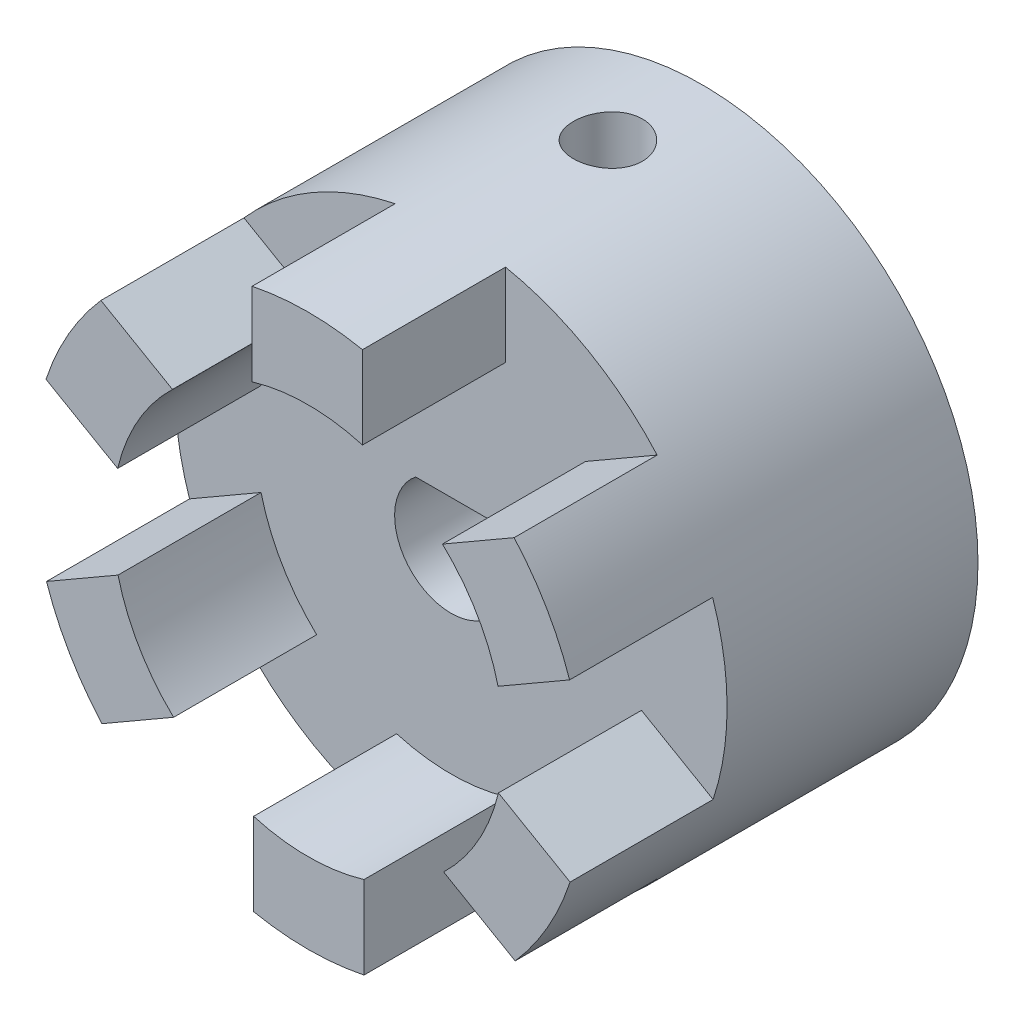
from build123d import *

# Parameters (mm, degrees)
BOSS_EXTRUDE1_DEPTH   = 11.4
BOSS_EXTRUDE1_2_DEPTH = 11.4
BOSS_EXTRUDE1_3_DEPTH = 11.4
BOSS_EXTRUDE1_4_DEPTH = 11.4
BOSS_EXTRUDE1_5_DEPTH = 11.4
BOSS_EXTRUDE1_6_DEPTH = 11.4
BOSS_EXTRUDE2_START   = -20
SKETCH1_6_R           = 22
BOSS_EXTRUDE2_DEPTH   = 20
SKETCH2_R             = 2.75
CUT_EXTRUDE1_DEPTH    = 30


with BuildPart() as part:
    # Sketch1 → Boss-Extrude1 (new body)
    with BuildSketch(Plane.XY):
        with BuildLine():
            ThreePointArc((-4.460468257, 14.948719776), (-0.063074903, 15.599872485), (4.339440194, 14.984300411))
            Line((4.339440194, 14.984300411), (4.339440194, 21.56778289))
            ThreePointArc((4.339440194, 21.56778289), (-0.061761858, 21.999913306), (-4.460468257, 21.543078307))
            Line((-4.460468257, 21.543078307), (-4.460468257, 14.948719776))
        make_face()
    extrude(amount=BOSS_EXTRUDE1_DEPTH)



with BuildPart() as body_2:
    # Sketch1 → Boss-Extrude1 2 (new body)
    with BuildSketch(Plane.XY):
        with BuildLine():
            Line((16.426618961, 14.634417977), (10.715736951, 11.337238711))
            ThreePointArc((10.715736951, 11.337238711), (13.478348416, 7.854560711), (15.146504911, 3.734084759))
            Line((15.146504911, 3.734084759), (20.847967983, 7.025825999))
            ThreePointArc((20.847967983, 7.025825999), (19.021602875, 11.053443991), (16.426618961, 14.634417977))
        make_face()
    extrude(amount=BOSS_EXTRUDE1_2_DEPTH)


with BuildPart() as body_3:
    # Sketch1 → Boss-Extrude1 3 (new body)
    with BuildSketch(Plane.XY):
        with BuildLine():
            ThreePointArc((-15.176205208, 3.611481064), (-13.54142332, 7.745311774), (-10.807064717, 11.250215651))
            Line((-10.807064717, 11.250215651), (-16.508527789, 14.541956891))
            ThreePointArc((-16.508527789, 14.541956891), (-19.083364733, 10.946469315), (-20.887087218, 6.90866033))
            Line((-20.887087218, 6.90866033), (-15.176205208, 3.611481064))
        make_face()
    extrude(amount=BOSS_EXTRUDE1_3_DEPTH)


with BuildPart() as body_4:
    # Sketch1 → Boss-Extrude1 4 (new body)
    with BuildSketch(Plane.XY):
        with BuildLine():
            Line((20.887087218, -6.90866033), (15.176205208, -3.611481064))
            ThreePointArc((15.176205208, -3.611481064), (13.54142332, -7.745311774), (10.807064717, -11.250215651))
            Line((10.807064717, -11.250215651), (16.508527789, -14.541956891))
            ThreePointArc((16.508527789, -14.541956891), (19.083364733, -10.946469315), (20.887087218, -6.90866033))
        make_face()
    extrude(amount=BOSS_EXTRUDE1_4_DEPTH)


with BuildPart() as body_5:
    # Sketch1 → Boss-Extrude1 5 (new body)
    with BuildSketch(Plane.XY):
        with BuildLine():
            ThreePointArc((-10.715736951, -11.337238711), (-13.478348416, -7.854560711), (-15.146504911, -3.734084759))
            Line((-15.146504911, -3.734084759), (-20.847967983, -7.025825999))
            ThreePointArc((-20.847967983, -7.025825999), (-19.021602875, -11.053443991), (-16.426618961, -14.634417977))
            Line((-16.426618961, -14.634417977), (-10.715736951, -11.337238711))
        make_face()
    extrude(amount=BOSS_EXTRUDE1_5_DEPTH)


with BuildPart() as body_6:
    # Sketch1 → Boss-Extrude1 6 (new body)
    with BuildSketch(Plane.XY):
        with BuildLine():
            Line((4.460468257, -21.543078307), (4.460468257, -14.948719776))
            ThreePointArc((4.460468257, -14.948719776), (0.063074903, -15.599872485), (-4.339440194, -14.984300411))
            Line((-4.339440194, -14.984300411), (-4.339440194, -21.56778289))
            ThreePointArc((-4.339440194, -21.56778289), (0.061761858, -21.999913306), (4.460468257, -21.543078307))
        make_face()
    extrude(amount=BOSS_EXTRUDE1_6_DEPTH)


with BuildPart() as part_1:
    add(part.part)

    add(body_2.part)  # Boss-Extrude2 merges body 2

    add(body_3.part)  # Boss-Extrude2 merges body 3

    add(body_4.part)  # Boss-Extrude2 merges body 4

    add(body_5.part)  # Boss-Extrude2 merges body 5

    add(body_6.part)  # Boss-Extrude2 merges body 6
    # Sketch1<6> → Boss-Extrude2 (add)
    with BuildSketch(Plane.XY.offset(BOSS_EXTRUDE2_START)):
        Circle(SKETCH1_6_R)
        with BuildLine():
            Line((-2.828427125, 3.5), (2.828427125, 3.5))
            ThreePointArc((2.828427125, 3.5), (0, -4.5), (-2.828427125, 3.5))
        make_face(mode=Mode.SUBTRACT)
    extrude(amount=BOSS_EXTRUDE2_DEPTH)

    # Sketch2 → Cut-Extrude1 (cut)
    with BuildSketch(Plane(origin=(0, 0, 0), x_dir=(1, 0, 0), z_dir=(0, 1, 0))):
        with Locations((0, 12.5)):
            Circle(SKETCH2_R)
    extrude(amount=CUT_EXTRUDE1_DEPTH, mode=Mode.SUBTRACT)


solid = part_1.part
